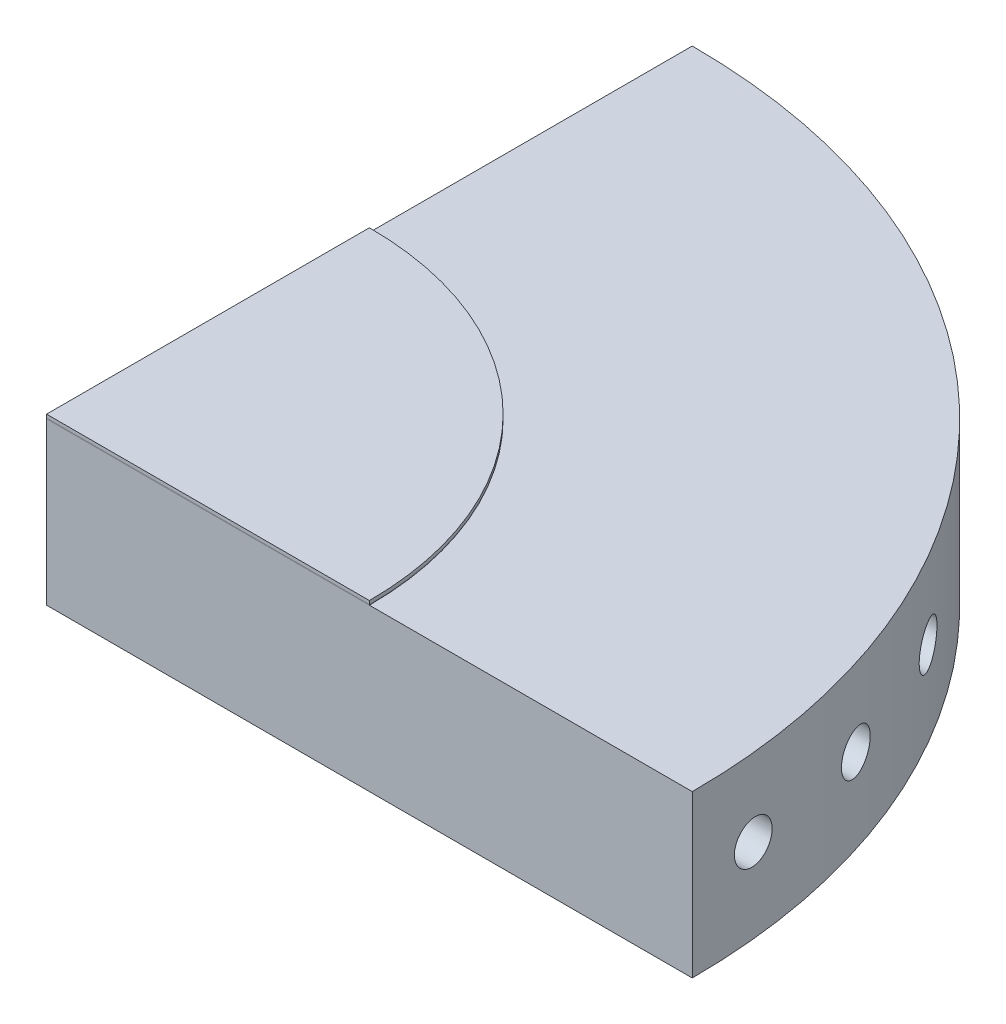
from build123d import *

# Parameters (mm, degrees)
SKETCH1_R               = 100
BOSS_EXTRUDE1_DEPTH     = 25
SKETCH2_R               = 50
BOSS_EXTRUDE2_DEPTH     = 0.1
SKETCH4_R               = 50
BOSS_EXTRUDE3_DEPTH     = 0.525
CUT_EXTRUDE1_DEPTH      = 144.724182464
CUT_EXTRUDE1_DEPTH_BACK = 144.724182464
SKETCH5_R               = 3.25
SKETCH6_R               = 1.5
CUT_EXTRUDE3_DEPTH      = 20.5
CUT_EXTRUDE4_DEPTH      = 144.724182603
CUT_EXTRUDE4_DEPTH_BACK = 144.724182603
SKETCH8_OUTSIDE_W       = 258.8
SKETCH8_OUTSIDE_H       = 258.8
SKETCH8_OUTSIDE_W_2     = 122.671800347
SKETCH8_OUTSIDE_H_2     = 113.648228552


with BuildPart() as part:
    # Sketch1 → Boss-Extrude1 (new body)
    with BuildSketch(Plane(origin=(0, 0, 0), x_dir=(1, 0, 0), z_dir=(0, 1, 0))):
        with Locations(Location((0, 0, 0), (0, 0, 270))):
            Circle(SKETCH1_R)
    extrude(amount=BOSS_EXTRUDE1_DEPTH)

    # Sketch5 → Cut-Extrude1 (cut, two sides: drawn at the far end of the back side and taken through both)
    with BuildSketch(Plane(origin=(0, 0, 0), x_dir=(0, 0, -1), z_dir=(1, 0, 0)).offset(-CUT_EXTRUDE1_DEPTH_BACK)):
        with Locations((10, 13)):
            Circle(SKETCH5_R)
        with Locations((30, 13)):
            Circle(SKETCH5_R)
        with Locations((50, 13)):
            Circle(SKETCH5_R)
    extrude(amount=CUT_EXTRUDE1_DEPTH + CUT_EXTRUDE1_DEPTH_BACK, mode=Mode.SUBTRACT)

    # Sketch6 → Cut-Extrude3 (cut)
    with BuildSketch(Plane.XZ):
        with Locations(Location((15, -20, 0), (0, 0, 270))):
            Circle(SKETCH6_R)
        with Locations(Location((60, -60, 0), (0, 0, 270))):
            Circle(SKETCH6_R)
    extrude(amount=-CUT_EXTRUDE3_DEPTH, mode=Mode.SUBTRACT)


with BuildPart() as body_2:
    # Sketch2 → Boss-Extrude2 (new body)
    with BuildSketch(Plane(origin=(0, 25, 0), x_dir=(1, 0, 0), z_dir=(0, 1, 0))):
        with Locations(Location((0, 0, 0), (0, 0, 270))):
            Circle(SKETCH2_R)
    extrude(amount=BOSS_EXTRUDE2_DEPTH)


with BuildPart() as body_3:
    # Sketch4 → Boss-Extrude3 (new body)
    with BuildSketch(Plane(origin=(0, 25.1, 0), x_dir=(1, 0, 0), z_dir=(0, 1, 0))):
        with Locations(Location((0, 0, 0), (0, 0, 270))):
            Circle(SKETCH4_R)
    extrude(amount=BOSS_EXTRUDE3_DEPTH)


with BuildPart() as cut_extrude4_tool:
    # Sketch8 outside → Cut-Extrude4 (new, two sides: drawn at the far end of the back side and taken through both)
    with BuildSketch(Plane.XZ.offset(-CUT_EXTRUDE4_DEPTH_BACK)):
        Rectangle(SKETCH8_OUTSIDE_W, SKETCH8_OUTSIDE_H)
        with Locations((61.335900174, -56.824114276)):
            Rectangle(SKETCH8_OUTSIDE_W_2, SKETCH8_OUTSIDE_H_2, mode=Mode.SUBTRACT)
    extrude(amount=CUT_EXTRUDE4_DEPTH + CUT_EXTRUDE4_DEPTH_BACK)


with BuildPart() as part_1:
    add(part.part)

    # Cut-Extrude4: cut by cut_extrude4_tool
    add(cut_extrude4_tool.part, mode=Mode.SUBTRACT)


with BuildPart() as body_2_1:
    add(body_2.part)

    # Cut-Extrude4: cut by cut_extrude4_tool
    add(cut_extrude4_tool.part, mode=Mode.SUBTRACT)


with BuildPart() as body_3_1:
    add(body_3.part)

    # Cut-Extrude4: cut by cut_extrude4_tool
    add(cut_extrude4_tool.part, mode=Mode.SUBTRACT)


solid = Compound([part_1.part, body_2_1.part, body_3_1.part])
